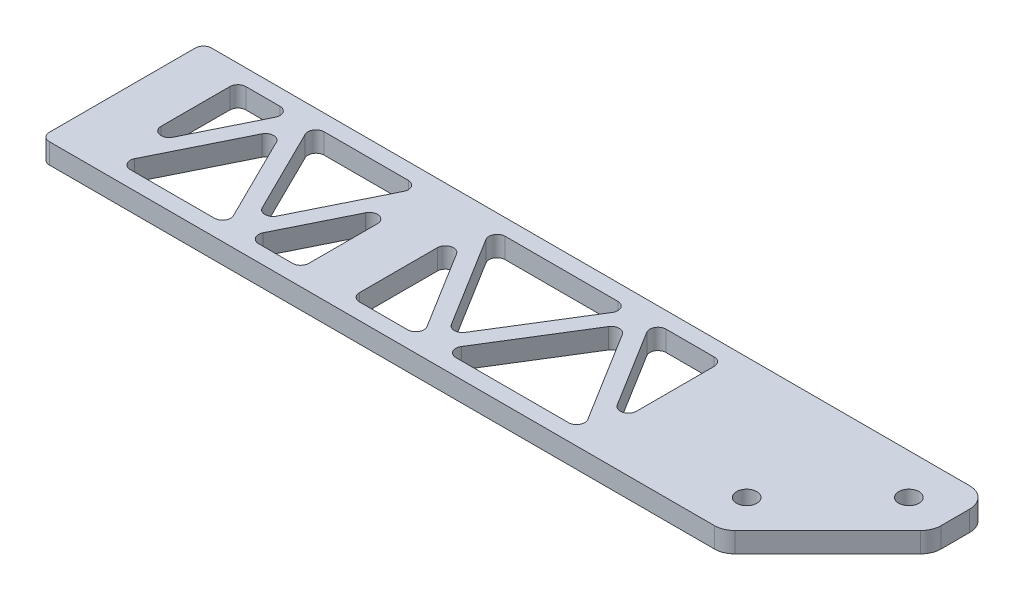
from build123d import *

# Parameters (mm, degrees)
SKETCH1_R           = 3.175
BOSS_EXTRUDE1_DEPTH = 3.175
FILLET1_R           = 2.54
FILLET2_R           = 6.35


with BuildPart() as part:
    # Sketch1 → Boss-Extrude1 (new, symmetric)
    with BuildSketch(Plane(origin=(0, 0, 0), x_dir=(1, 0, 0), z_dir=(0, 1, 0))):
        Polygon((121.465512242, -25.4), (154.305, 7.439487758), (154.305, 25.4), (-92.075, 25.4), (-92.075, -25.4), align=None)
        Polygon((-38.817248104, -20.32), (-73.366085229, -20.32), (-56.091666667, 14.592509095), align=None, mode=Mode.SUBTRACT)
        Polygon((-15.875, 14.592509095), (-15.875, -20.32), (-33.149418563, -20.32), align=None, mode=Mode.SUBTRACT)
        Polygon((22.200034711, -20.32), (0, -20.32), (0, 15.498543399), align=None, mode=Mode.SUBTRACT)
        with Locations(Location((116.205, -12.7, 0), (0, 0, 270))):
            Circle(SKETCH1_R, mode=Mode.SUBTRACT)
        Polygon((72.576701378, -20.32), (28.176631956, -20.32), (50.376666667, 15.498543399), align=None, mode=Mode.SUBTRACT)
        Polygon((53.364965289, 20.32), (75.565, 20.32), (75.565, -15.498543399), align=None, mode=Mode.SUBTRACT)
        Polygon((-76.2, -14.592509095), (-76.2, 20.32), (-58.925581437, 20.32), align=None, mode=Mode.SUBTRACT)
        Polygon((-53.257751896, 20.32), (-18.708914771, 20.32), (-35.983333333, -14.592509095), align=None, mode=Mode.SUBTRACT)
        Polygon((2.988298622, 20.32), (47.388368044, 20.32), (25.188333333, -15.498543399), align=None, mode=Mode.SUBTRACT)
        with Locations(Location((141.605, 12.7, 0), (0, 0, 270))):
            Circle(SKETCH1_R, mode=Mode.SUBTRACT)
    extrude(amount=BOSS_EXTRUDE1_DEPTH, both=True)

    # Fillet1
    fillet1_edges = [part.edges().sort_by_distance(p)[0] for p in [
        (-76.2, 0, -20.32),
        (-76.2, 0, 14.592509095),
        (-58.925581437, 0, -20.32),
        (2.988298622, 0, -20.32),
        (25.188333333, 0, 15.498543399),
        (47.388368044, 0, -20.32),
        (0, 0, -15.498543399),
        (0, 0, 20.32),
        (22.200034711, 0, 20.32),
        (72.576701378, 0, 20.32),
        (50.376666667, 0, -15.498543399),
        (28.176631956, 0, 20.32),
        (75.565, 0, 15.498543399),
        (75.565, 0, -20.32),
        (53.364965289, 0, -20.32),
        (-15.875, 0, 20.32),
        (-15.875, 0, -14.592509095),
        (-33.149418563, 0, 20.32),
        (-35.983333333, 0, 14.592509095),
        (-18.708914771, 0, -20.32),
        (-53.257751896, 0, -20.32),
        (-92.075, 0, 25.4),
        (-92.075, 0, -25.4),
        (-38.817248104, 0, 20.32),
        (-56.091666667, 0, -14.592509095),
        (-73.366085229, 0, 20.32),
    ]]
    fillet(fillet1_edges, radius=FILLET1_R)

    # Fillet2
    fillet2_edges = [part.edges().sort_by_distance(p)[0] for p in [
        (154.305, 0, -25.4),
        (154.305, 0, -7.439487758),
        (121.465512242, 0, 25.4),
    ]]
    fillet(fillet2_edges, radius=FILLET2_R)


solid = part.part
